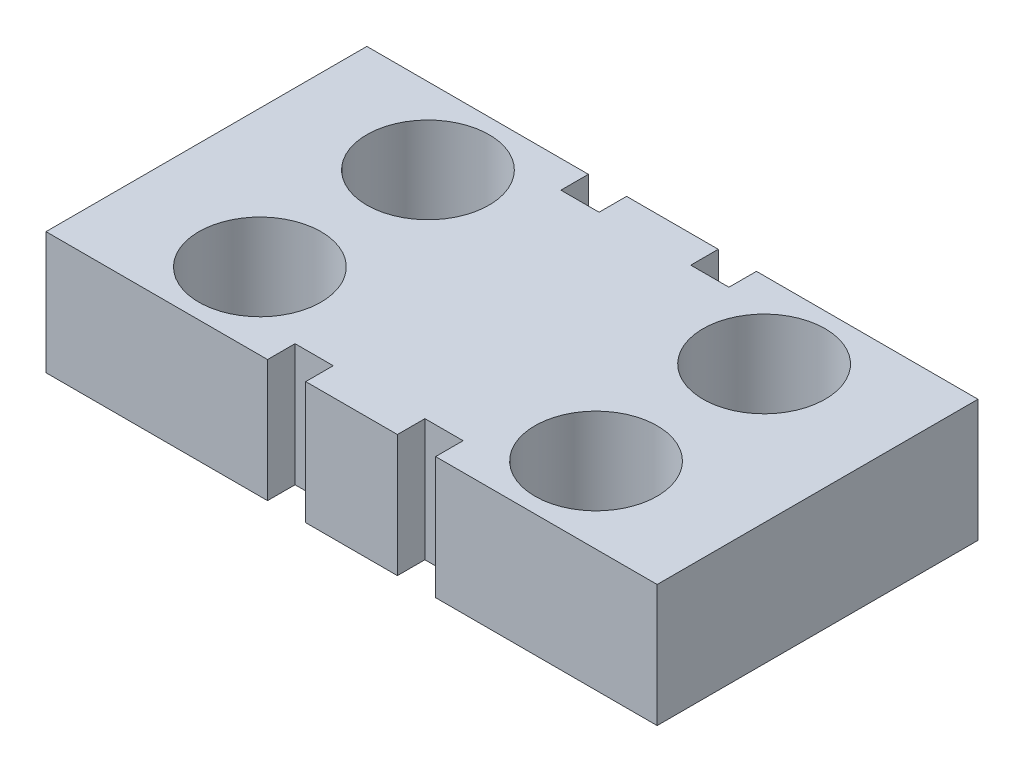
from build123d import *

# Parameters (mm, degrees)
SKETCH1_W           = 40
SKETCH1_H           = 21
BOSS_EXTRUDE1_DEPTH = 8
SKETCH2_R           = 4
CUT_EXTRUDE1_DEPTH  = 7
SKETCH3_R           = 2.5
CUT_EXTRUDE2_DEPTH  = 5
SKETCH4_W           = 2.5
SKETCH4_H           = 1.8
CUT_EXTRUDE3_DEPTH  = 15


with BuildPart() as part:
    # Sketch1 → Boss-Extrude1 (new body)
    with BuildSketch(Plane(origin=(0, 0, 0), x_dir=(1, 0, 0), z_dir=(0, 1, 0))):
        with Locations((-20, 10.5)):
            Rectangle(SKETCH1_W, SKETCH1_H)
    extrude(amount=BOSS_EXTRUDE1_DEPTH)

    # Sketch2 → Cut-Extrude1 (cut)
    with BuildSketch(Plane(origin=(0, 8, 0), x_dir=(1, 0, 0), z_dir=(0, 1, 0))):
        with Locations(Location((-31, 16, 0), (0, 0, 270))):
            Circle(SKETCH2_R)
        with Locations(Location((-31, 5, 0), (0, 0, 90))):
            Circle(SKETCH2_R)
        with Locations(Location((-9, 5, 0), (0, 0, 270))):
            Circle(SKETCH2_R)
        with Locations(Location((-9, 16, 0), (0, 0, 90))):
            Circle(SKETCH2_R)
    extrude(amount=-CUT_EXTRUDE1_DEPTH, mode=Mode.SUBTRACT)

    # Sketch3 → Cut-Extrude2 (cut)
    with BuildSketch(Plane.XZ):
        with Locations(Location((-20, -10.5, 0), (0, 0, 270))):
            Circle(SKETCH3_R)
    extrude(amount=-CUT_EXTRUDE2_DEPTH, mode=Mode.SUBTRACT)

    # Sketch4 → Cut-Extrude3 (cut)
    with BuildSketch(Plane.XZ):
        with Locations((-15.75, -0.9)):
            Rectangle(SKETCH4_W, SKETCH4_H)
        with Locations((-24.25, -0.9)):
            Rectangle(SKETCH4_W, SKETCH4_H)
        with Locations((-15.75, -20.1)):
            Rectangle(SKETCH4_W, SKETCH4_H)
        with Locations((-24.25, -20.1)):
            Rectangle(SKETCH4_W, SKETCH4_H)
    extrude(amount=-CUT_EXTRUDE3_DEPTH, mode=Mode.SUBTRACT)


solid = part.part
